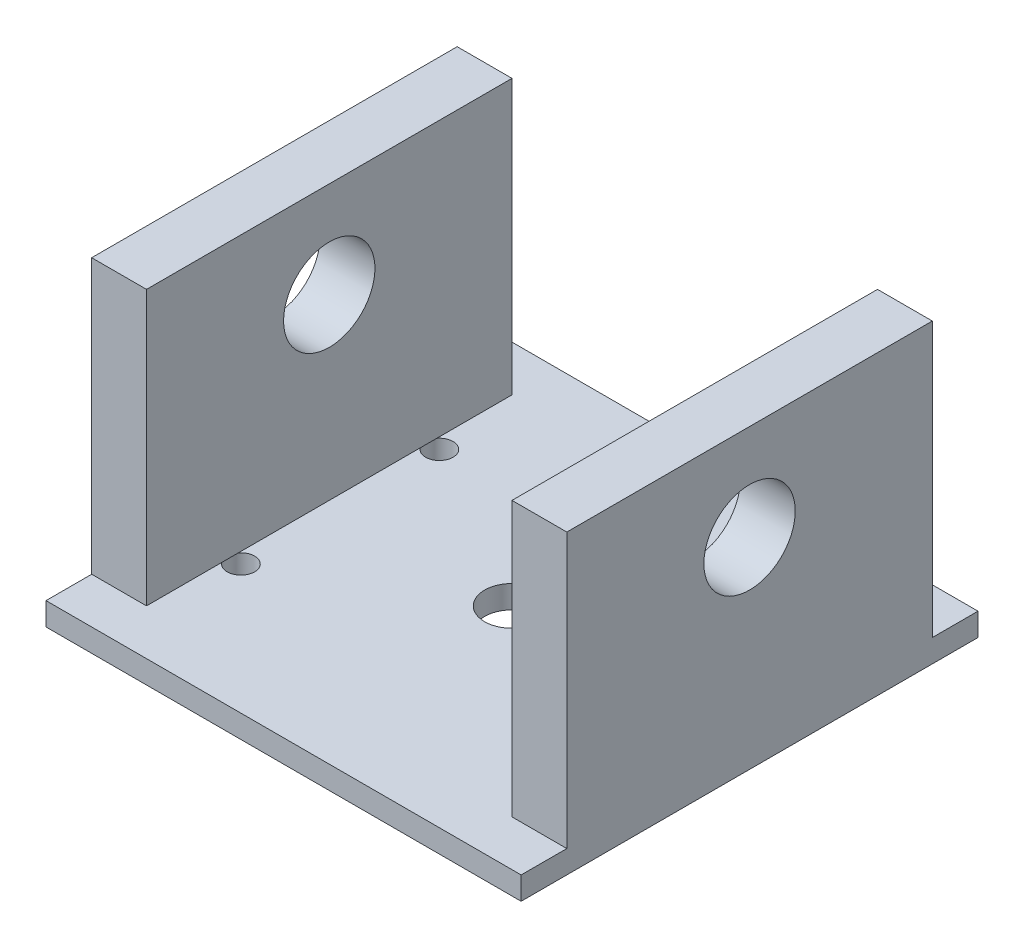
from build123d import *

# Parameters (mm, degrees)
SKETCH1_W               = 104
SKETCH1_H               = 100
SKETCH1_R               = 3
SKETCH1_R_2             = 6
BOSS_EXTRUDE1_DEPTH     = 5
SKETCH2_W               = 12
SKETCH2_H               = 80
BOSS_EXTRUDE2_DEPTH     = 60
CUT_EXTRUDE1_DEPTH      = 133.442440328
CUT_EXTRUDE1_DEPTH_BACK = 133.442440328
SKETCH3_R               = 10


with BuildPart() as part:
    # Sketch1 → Boss-Extrude1 (new body)
    with BuildSketch(Plane(origin=(0, 0, 0), x_dir=(1, 0, 0), z_dir=(0, 1, 0))):
        Rectangle(SKETCH1_W, SKETCH1_H)
        with Locations(Location((-37.62, -21.72, 0), (0, 0, 270))):
            Circle(SKETCH1_R, mode=Mode.SUBTRACT)
        with Locations(Location((37.62, -21.72, 0), (0, 0, 90))):
            Circle(SKETCH1_R, mode=Mode.SUBTRACT)
        with Locations(Location((37.62, 21.72, 0), (0, 0, 270))):
            Circle(SKETCH1_R, mode=Mode.SUBTRACT)
        with Locations(Location((-37.62, 21.72, 0), (0, 0, 90))):
            Circle(SKETCH1_R, mode=Mode.SUBTRACT)
        with Locations(Location((0, 0, 0), (0, 0, 270))):
            Circle(SKETCH1_R_2, mode=Mode.SUBTRACT)
    extrude(amount=BOSS_EXTRUDE1_DEPTH)

    # Sketch2 → Boss-Extrude2 (add)
    with BuildSketch(Plane(origin=(0, 5, 0), x_dir=(1, 0, 0), z_dir=(0, 1, 0))):
        with Locations((-46, 0)):
            Rectangle(SKETCH2_W, SKETCH2_H)
        with Locations((46, 0)):
            Rectangle(SKETCH2_W, SKETCH2_H)
    extrude(amount=BOSS_EXTRUDE2_DEPTH)

    # Sketch3 → Cut-Extrude1 (cut, two sides: drawn at the far end of the back side and taken through both)
    with BuildSketch(Plane.ZY.offset(52).offset(-CUT_EXTRUDE1_DEPTH_BACK)):
        with Locations((0, 44)):
            Circle(SKETCH3_R)
    extrude(amount=CUT_EXTRUDE1_DEPTH + CUT_EXTRUDE1_DEPTH_BACK, mode=Mode.SUBTRACT)


solid = part.part
